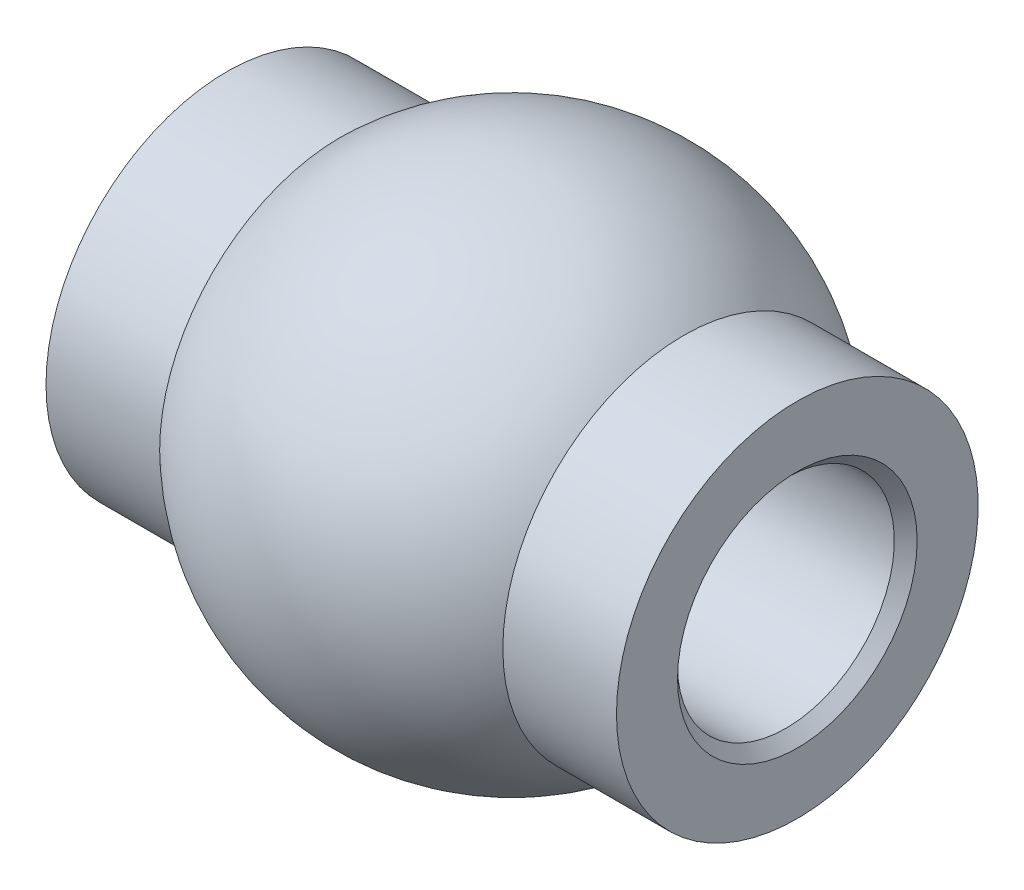
from build123d import *

# Parameters (mm, degrees)
CHAMFER1_SIZE = 0.254


with BuildPart() as part:
    # Sketch1 → Revolve1 (revolve)
    with BuildSketch(Plane.XY, mode=Mode.PRIVATE) as revolve1_sk:
        with BuildLine():
            Line((-6.35, 4.0259), (-6.35, 2.413))
            Line((-6.35, 2.413), (6.35, 2.413))
            Line((6.35, 2.413), (6.35, 4.0259))
            Line((6.35, 4.0259), (3.820146489, 4.0259))
            ThreePointArc((3.820146489, 4.0259), (0, 5.5499), (-3.820146489, 4.0259))
            Line((-3.820146489, 4.0259), (-6.35, 4.0259))
        make_face()
    revolve(revolve1_sk.sketch.rotate(Axis((-18.157637283, 0, 0), (1, 0, 0)), 90), axis=Axis((-18.157637283, 0, 0), (1, 0, 0)))

    # Chamfer1
    chamfer1_edges = [part.edges().sort_by_distance(p)[0] for p in [
        (-6.35, 0, -2.413),
        (6.35, 0, -2.413),
    ]]
    chamfer(chamfer1_edges, length=CHAMFER1_SIZE)


solid = part.part
